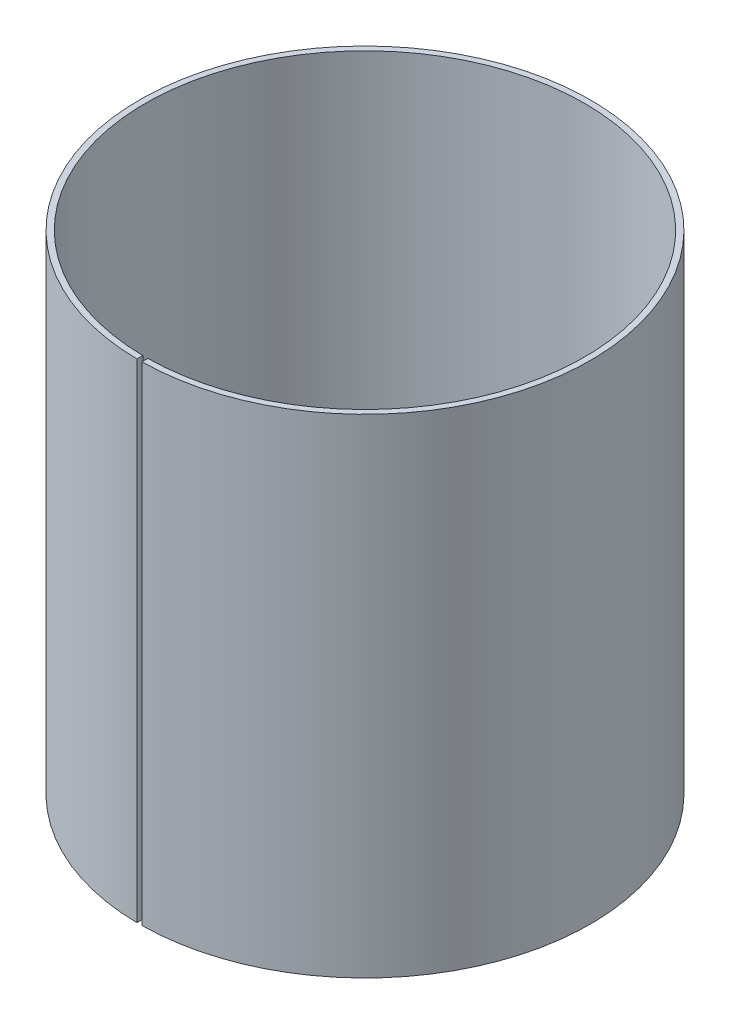
from build123d import *

# Parameters (mm, degrees)
SKETCH_1_R          = 46.2
SKETCH_1_R_2        = 45
EXTRUDE_1_DEPTH     = 100
SKETCH_2_W          = 1
SKETCH_2_H          = 100
CUT_EXTRUDE_1_DEPTH = 93


with BuildPart() as part:
    # Эскиз1 → Бобышка-Вытянуть1 (new body)
    with BuildSketch(Plane(origin=(0, 0, 0), x_dir=(1, 0, 0), z_dir=(0, 1, 0))):
        with Locations(Location((0, 0, 0), (0, 0, 270))):
            Circle(SKETCH_1_R)
        with Locations(Location((0, 0, 0), (0, 0, 270))):
            Circle(SKETCH_1_R_2, mode=Mode.SUBTRACT)
    extrude(amount=EXTRUDE_1_DEPTH)

    # Эскиз2 → Вырез-Вытянуть1 (cut)
    with BuildSketch(Plane.XY):
        with Locations((0, 50)):
            Rectangle(SKETCH_2_W, SKETCH_2_H)
    extrude(amount=CUT_EXTRUDE_1_DEPTH, mode=Mode.SUBTRACT)


solid = part.part
